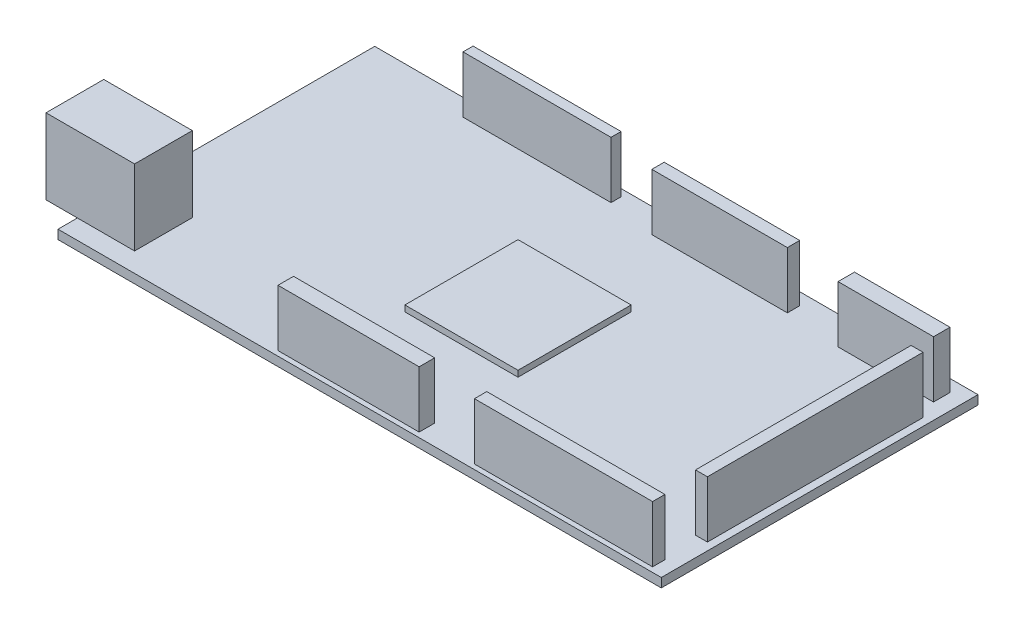
from build123d import *

# Parameters (mm, degrees)
SKETCH1_W           = 101.6
SKETCH1_H           = 53.34
BOSS_EXTRUDE1_DEPTH = 1.524
SKETCH2_W           = 19.05
SKETCH2_H           = 19.05
BOSS_EXTRUDE2_DEPTH = 1.016
SKETCH3_W           = 14.918140665
SKETCH3_H           = 9.726042688
BOSS_EXTRUDE3_DEPTH = 12.7
SKETCH4_W           = 24.926999196
SKETCH4_H           = 1.692574019
SKETCH4_W_2         = 22.820903589
SKETCH4_H_2         = 2.077249933
SKETCH4_W_3         = 16.079453185
SKETCH4_H_3         = 2.769666577
SKETCH4_W_4         = 2.00031475
SKETCH4_H_4         = 36.313406236
SKETCH4_W_5         = 30.004721254
SKETCH4_W_6         = 23.772971456
SKETCH4_H_5         = 2.615796212
BOSS_EXTRUDE4_DEPTH = 9.525


with BuildPart() as part:
    # Sketch1 → Boss-Extrude1 (new body)
    with BuildSketch(Plane(origin=(0, 0, 0), x_dir=(1, 0, 0), z_dir=(0, 1, 0))):
        Rectangle(SKETCH1_W, SKETCH1_H)
    extrude(amount=BOSS_EXTRUDE1_DEPTH)

    # Sketch2 → Boss-Extrude2 (add)
    with BuildSketch(Plane(origin=(0, 1.524, 0), x_dir=(1, 0, 0), z_dir=(0, 1, 0))):
        Rectangle(SKETCH2_W, SKETCH2_H)
    extrude(amount=BOSS_EXTRUDE2_DEPTH)

    # Sketch3 → Boss-Extrude3 (add)
    with BuildSketch(Plane(origin=(0, 1.524, 0), x_dir=(1, 0, 0), z_dir=(0, 1, 0))):
        with Locations((-48.63021344, -18.537983619)):
            Rectangle(SKETCH3_W, SKETCH3_H)
    extrude(amount=BOSS_EXTRUDE3_DEPTH)

    # Sketch4 → Boss-Extrude4 (add)
    with BuildSketch(Plane(origin=(0, 1.524, 0), x_dir=(1, 0, 0), z_dir=(0, 1, 0))):
        with Locations((-20.570539456, 24.619258466)):
            Rectangle(SKETCH4_W, SKETCH4_H)
        with Locations((11.410451795, 23.580633498)):
            Rectangle(SKETCH4_W_2, SKETCH4_H_2)
        with Locations((40.092852107, 23.234425177)):
            Rectangle(SKETCH4_W_3, SKETCH4_H_3)
        with Locations((48.517254612, 0.538546279)):
            Rectangle(SKETCH4_W_4, SKETCH4_H_4)
        with Locations((33.514893985, -24.811596423)):
            Rectangle(SKETCH4_W_5, SKETCH4_H_2)
        with Locations((-2.683109477, -24.542323283)):
            Rectangle(SKETCH4_W_6, SKETCH4_H_5)
    extrude(amount=BOSS_EXTRUDE4_DEPTH)


solid = part.part
